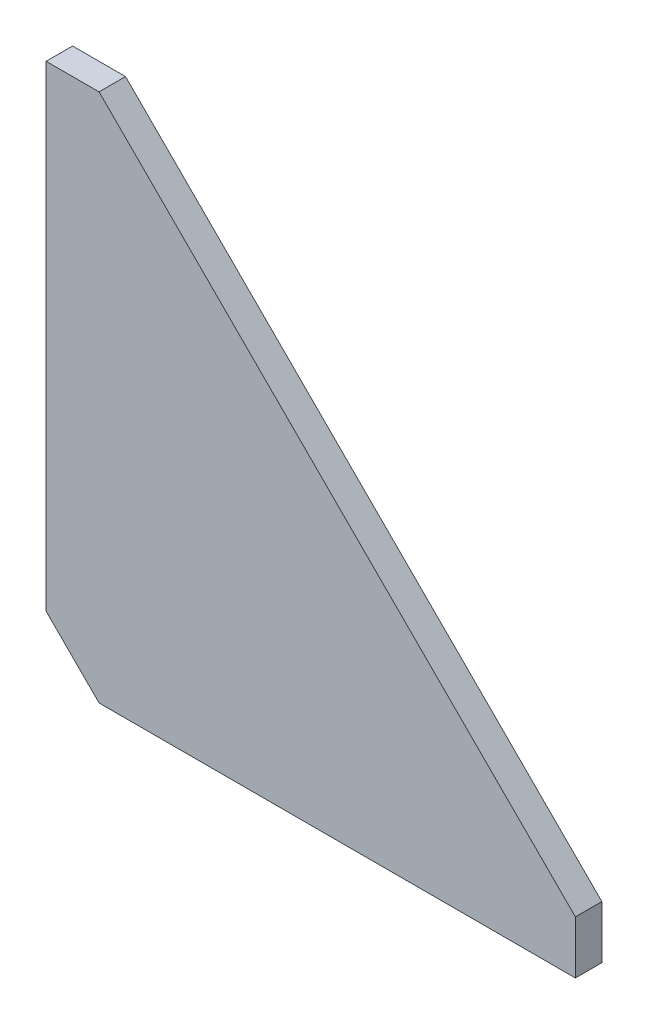
from build123d import *

# Parameters (mm, degrees)
EXTRUDE_1_DEPTH = 2.5
CHAMFER_1_SIZE  = 10


with BuildPart() as part:
    # Эскиз1 → Бобышка-Вытянуть1 (new, symmetric)
    with BuildSketch(Plane.XY):
        Polygon((0, 0), (0, 100), (10, 100), (100, 10), (100, 0), align=None)
    extrude(amount=EXTRUDE_1_DEPTH, both=True)

    # Фаска1
    chamfer_1_edges = [part.edges().sort_by_distance(p)[0] for p in [
        (0, 0, 0),
    ]]
    chamfer(chamfer_1_edges, length=CHAMFER_1_SIZE)


solid = part.part
